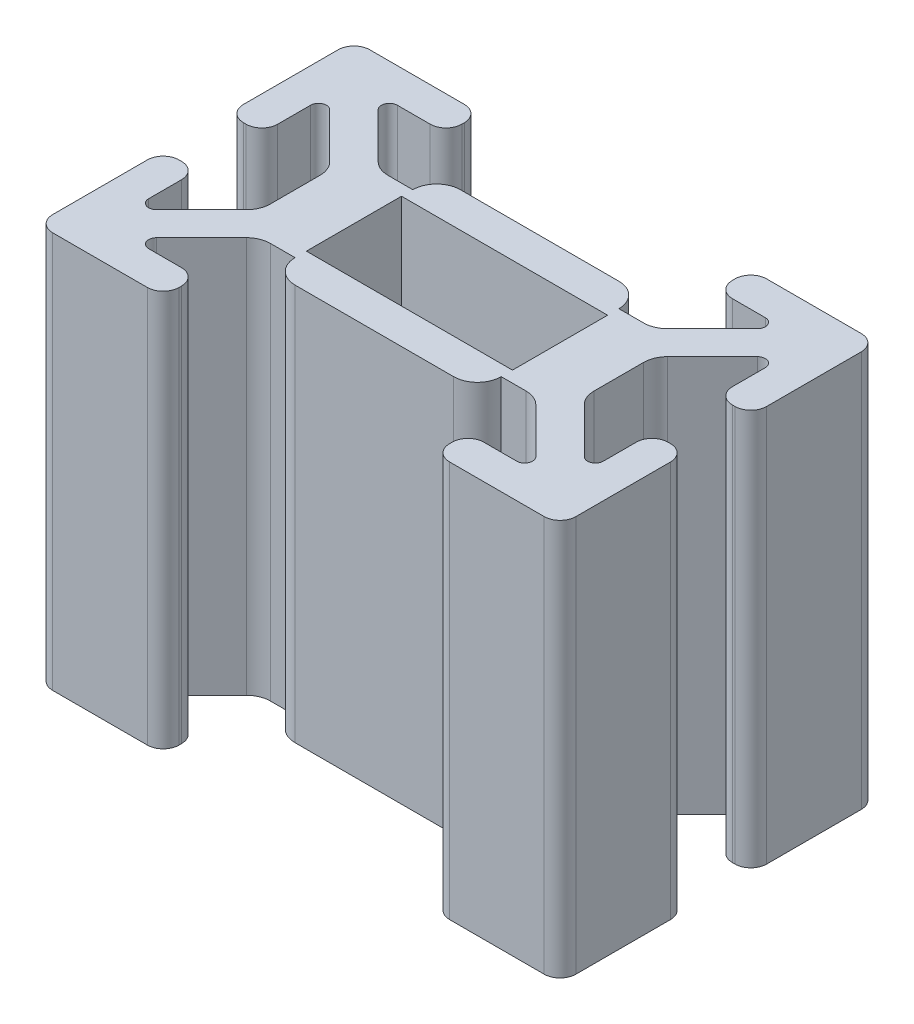
from build123d import *

# Parameters (mm, degrees)
BOSS_EXTRUDE3_DEPTH = 50
SKETCH4_W           = 14.85
SKETCH4_H           = 5
BOSS_EXTRUDE4_DEPTH = 26
SKETCH6_W           = 26
SKETCH6_H           = 5
BOSS_EXTRUDE5_DEPTH = 3
SKETCH7_W           = 26
SKETCH7_H           = 5
BOSS_EXTRUDE6_DEPTH = 3
BOSS_EXTRUDE7_DEPTH = 45
CUT_EXTRUDE1_START  = -5
CUT_EXTRUDE1_DEPTH  = 5


with BuildPart() as part:
    # Sketch1 → Boss-Extrude3 (new body)
    with BuildSketch(Plane(origin=(0, 0, 0), x_dir=(1, 0, 0), z_dir=(0, 1, 0))):
        with BuildLine():
            ThreePointArc((4.065, -18), (4.650786438, -19.414213562), (6.065, -20))
            Line((6.065, -20), (18, -20))
            ThreePointArc((18, -20), (19.414213562, -19.414213562), (20, -18))
            Line((20, -18), (20, -15.68))
            Line((20, -15.68), (20, -6.065))
            ThreePointArc((20, -6.065), (19.414213562, -4.650786438), (18, -4.065))
            Line((18, -4.065), (17.68, -4.065))
            ThreePointArc((17.68, -4.065), (16.265786438, -4.650786438), (15.68, -6.065))
            Line((15.68, -6.065), (15.68, -10.211786438))
            ThreePointArc((15.68, -10.211786438), (15.062683432, -11.13566597), (13.972893219, -10.918893219))
            Line((13.972893219, -10.918893219), (8.303679656, -5.249679656))
            ThreePointArc((8.303679656, -5.249679656), (7.653361402, -4.27640961), (7.425, -3.128359313))
            Line((7.425, -3.128359313), (7.425, 3.128359313))
            ThreePointArc((7.425, 3.128359313), (7.653361402, 4.27640961), (8.303679656, 5.249679656))
            Line((8.303679656, 5.249679656), (13.972893219, 10.918893219))
            ThreePointArc((13.972893219, 10.918893219), (15.062683432, 11.13566597), (15.68, 10.211786438))
            Line((15.68, 10.211786438), (15.68, 6.065))
            ThreePointArc((15.68, 6.065), (16.265786438, 4.650786438), (17.68, 4.065))
            Line((17.68, 4.065), (18, 4.065))
            ThreePointArc((18, 4.065), (19.414213562, 4.650786438), (20, 6.065))
            Line((20, 6.065), (20, 18))
            ThreePointArc((20, 18), (19.414213562, 19.414213562), (18, 20))
            Line((18, 20), (6.065, 20))
            ThreePointArc((6.065, 20), (4.650786438, 19.414213562), (4.065, 18))
            Line((4.065, 18), (4.065, 17.68))
            ThreePointArc((4.065, 17.68), (4.650786438, 16.265786438), (6.065, 15.68))
            Line((6.065, 15.68), (10.211786438, 15.68))
            ThreePointArc((10.211786438, 15.68), (11.13566597, 15.062683432), (10.918893219, 13.972893219))
            Line((10.918893219, 13.972893219), (5.249679656, 8.303679656))
            ThreePointArc((5.249679656, 8.303679656), (4.27640961, 7.653361402), (3.128359313, 7.425))
            Line((3.128359313, 7.425), (0, 7.425))
            Line((0, 7.425), (0, -7.425))
            Line((0, -7.425), (3.128359313, -7.425))
            ThreePointArc((3.128359313, -7.425), (4.27640961, -7.653361402), (5.249679656, -8.303679656))
            Line((5.249679656, -8.303679656), (10.918893219, -13.972893219))
            ThreePointArc((10.918893219, -13.972893219), (11.13566597, -15.062683432), (10.211786438, -15.68))
            Line((10.211786438, -15.68), (6.065, -15.68))
            ThreePointArc((6.065, -15.68), (4.650786438, -16.265786438), (4.065, -17.68))
            Line((4.065, -17.68), (4.065, -18))
        make_face()
    boss_extrude3 = extrude(amount=BOSS_EXTRUDE3_DEPTH)

    # Sketch4 → Boss-Extrude4 (add)
    with BuildSketch(Plane.ZY):
        with Locations((0, 2.5)):
            Rectangle(SKETCH4_W, SKETCH4_H)
    extrude(amount=BOSS_EXTRUDE4_DEPTH)

    # Mirror2: Boss-Extrude3 across plane
    add(boss_extrude3.mirror(Plane.ZY.offset(13)))

    # Sketch6 → Boss-Extrude5 (add)
    with BuildSketch(Plane.XY.offset(7.425)):
        with Locations((-13, 2.5)):
            Rectangle(SKETCH6_W, SKETCH6_H)
    extrude(amount=BOSS_EXTRUDE5_DEPTH)

    # Sketch7 → Boss-Extrude6 (add)
    with BuildSketch(Plane(origin=(0, 0, -7.425), x_dir=(-1, 0, 0), z_dir=(0, 0, -1))):
        with Locations((13, 2.5)):
            Rectangle(SKETCH7_W, SKETCH7_H)
    extrude(amount=BOSS_EXTRUDE6_DEPTH)

    # Sketch8 → Boss-Extrude7 (add)
    with BuildSketch(Plane(origin=(0, 5, 0), x_dir=(1, 0, 0), z_dir=(0, 1, 0))):
        with BuildLine():
            Line((-3, 10.425), (-23, 10.425))
            ThreePointArc((-23, 10.425), (-25.121320344, 9.546320344), (-26, 7.425))
            Line((-26, 7.425), (-26, 6))
            Line((-26, 6), (0, 6))
            Line((0, 6), (0, 7.425))
            ThreePointArc((0, 7.425), (-0.878679656, 9.546320344), (-3, 10.425))
        make_face()
        with BuildLine():
            Line((0, -7.425), (0, -6))
            Line((0, -6), (-26, -6))
            Line((-26, -6), (-26, -7.425))
            ThreePointArc((-26, -7.425), (-25.121320344, -9.546320344), (-23, -10.425))
            Line((-23, -10.425), (-3, -10.425))
            ThreePointArc((-3, -10.425), (-0.878679656, -9.546320344), (0, -7.425))
        make_face()
    extrude(amount=BOSS_EXTRUDE7_DEPTH)

    # Sketch9 → Cut-Extrude1 (cut)
    with BuildSketch(Plane(origin=(0, 5, 0), x_dir=(1, 0, 0), z_dir=(0, 1, 0)).offset(CUT_EXTRUDE1_START)):
        with BuildLine():
            ThreePointArc((0, -7.425), (-0.878679656, -9.546320344), (-3, -10.425))
            Line((-3, -10.425), (0, -10.425))
            Line((0, -10.425), (0, -7.425))
        make_face()
        with BuildLine():
            Line((-26, -7.425), (-26, -10.425))
            Line((-26, -10.425), (-23, -10.425))
            ThreePointArc((-23, -10.425), (-25.121320344, -9.546320344), (-26, -7.425))
        make_face()
        with BuildLine():
            Line((0, 7.425), (0, 10.425))
            Line((0, 10.425), (-3, 10.425))
            ThreePointArc((-3, 10.425), (-0.878679656, 9.546320344), (0, 7.425))
        make_face()
        with BuildLine():
            ThreePointArc((-26, 7.425), (-25.121320344, 9.546320344), (-23, 10.425))
            Line((-23, 10.425), (-26, 10.425))
            Line((-26, 10.425), (-26, 7.425))
        make_face()
    extrude(amount=CUT_EXTRUDE1_DEPTH, mode=Mode.SUBTRACT)


solid = part.part
